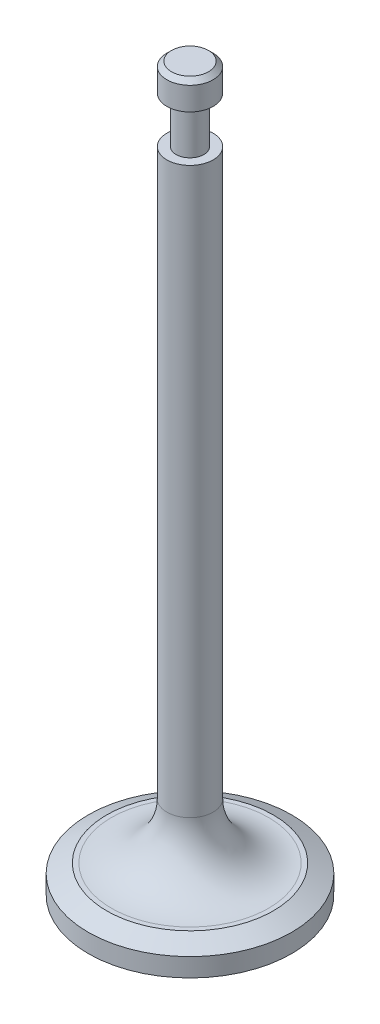
from build123d import *

# Parameters (mm, degrees)
FILLET1_R      = 6
CHAMFER1_SIZE  = 1
CHAMFER1_SIZE2 = 2
CHAMFER2_SIZE  = 0.5


with BuildPart() as part:
    # Sketch1 → Revolve1 (revolve)
    with BuildSketch(Plane(origin=(0, 0, 0), x_dir=(0, 0, -1), z_dir=(1, 0, 0)), mode=Mode.PRIVATE) as revolve1_sk:
        Polygon((0, 0), (0, -78.067128988), (11, -78.067128988), (11, -75.067128988), (2.5, -75.067128988), (2.5, -8), (1.5, -8), (1.5, -3), (2.5, -3), (2.5, 0), align=None)
    revolve(revolve1_sk.sketch.rotate(Axis((0, 0, 0), (0, -1, 0)), 180), axis=Axis((0, 0, 0), (0, -1, 0)))

    # Fillet1
    fillet1_edges = [part.edges().sort_by_distance(p)[0] for p in [
        (0, -75.067128988, -2.5),
    ]]
    fillet(fillet1_edges, radius=FILLET1_R)

    # Chamfer1
    chamfer1_edges = [part.edges().sort_by_distance(p)[0] for p in [
        (0, -75.067128988, -11),
    ]]
    chamfer1_side = [part.faces().sort_by_distance(p)[0] for p in [
        (0, -76.567128988, -11),
    ]]
    chamfer(chamfer1_edges, length=CHAMFER1_SIZE, length2=CHAMFER1_SIZE2, reference=chamfer1_side[0])

    # Chamfer2
    chamfer2_edges = [part.edges().sort_by_distance(p)[0] for p in [
        (0, 0, -2.5),
    ]]
    chamfer(chamfer2_edges, length=CHAMFER2_SIZE)


solid = part.part
